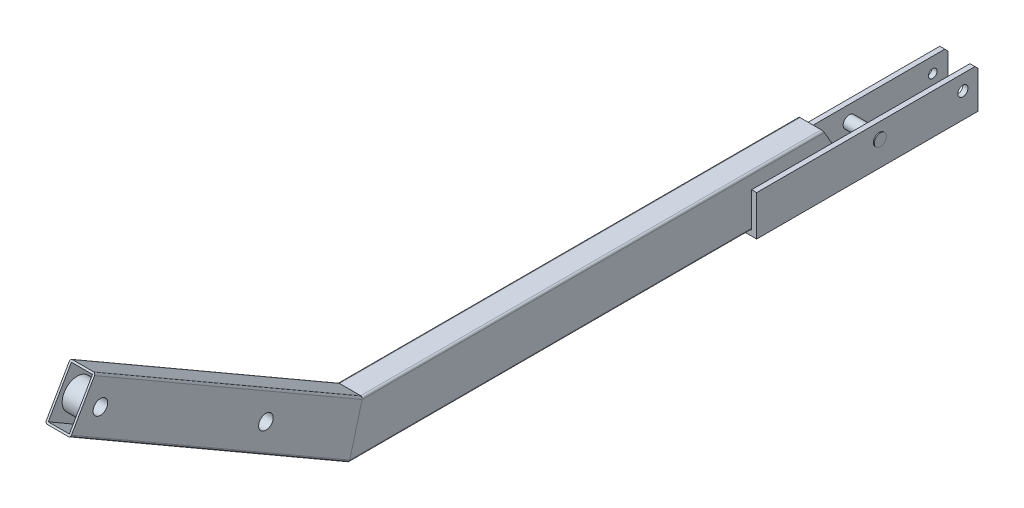
from build123d import *

# Parameters (mm, degrees)
SCHIZZO1_W                               = 21
SCHIZZO1_H                               = 46
ESTRUSIONE_SOTTILE1_DEPTH                = 500
TAGLIO_ESTRUSIONE1_DEPTH                 = 504.115294937
ESTRUSIONE_SOTTILE2_DEPTH                = 120
ESTRUSIONE_SOTTILE2_DEPTH_BACK           = 100
ESTRUSIONE_ESTRUSIONE3_DEPTH             = 1
ESTRUSIONE_ESTRUSIONE3_DEPTH_BACK        = 36
SCHIZZO6_R                               = 6
SCHIZZO7_R                               = 5
TAGLIO_ESTRUSIONE2_DEPTH                 = 10
SMUSSO1_SIZE                             = 3
TAGLIO_ESTRUSIONE3_DEPTH                 = 25
M10_TAPPED_HOLE1_D                       = 8.5
M10_TAPPED_HOLE1_DEPTH                   = 27.5
M10_TAPPED_HOLE1_TIP                     = 2.553657631
ESTRUSIONE_ESTRUSIONE5_DEPTH             = 12.5
RACCORDO1_R                              = 2
SCHIZZO12_W                              = 21
SCHIZZO12_H                              = 46
TAGLIO_ESTRUSIONE4_DEPTH                 = 862.794606464
TAGLIO_ESTRUSIONE5_DEPTH                 = 804.493488257
TAGLIO_ESTRUSIONE5_DEPTH_BACK            = 804.493488257
SCHIZZO13_R                              = 7.25
ESTRUSIONE_ESTRUSIONE6_REACH             = 805.493
SCHIZZO14_R                              = 15
SCHIZZO14_R_2                            = 7.25
ESTRUSIONE_ESTRUSIONE6_DIRECTION_2_REACH = 805.493


with BuildPart() as part:
    # Schizzo1 → Estrusione-Sottile1 (new body)
    with BuildSketch(Plane.XY):
        with BuildLine():
            Line((0, 48), (0, 2))
            ThreePointArc((0, 2), (0.585786438, 0.585786438), (2, 0))
            Line((2, 0), (23, 0))
            ThreePointArc((23, 0), (24.414213562, 0.585786438), (25, 2))
            Line((25, 2), (25, 48))
            ThreePointArc((25, 48), (24.414213562, 49.414213562), (23, 50))
            Line((23, 50), (2, 50))
            ThreePointArc((2, 50), (0.585786438, 49.414213562), (0, 48))
        make_face()
        with Locations((12.5, 25)):
            Rectangle(SCHIZZO1_W, SCHIZZO1_H, mode=Mode.SUBTRACT)
    extrude(amount=ESTRUSIONE_SOTTILE1_DEPTH)

    # Schizzo2 → Taglio-Estrusione1 (cut, through all)
    with BuildSketch(Plane(origin=(25, 0, 0), x_dir=(0, 0, -1), z_dir=(1, 0, 0))):
        Polygon((-500, 0), (-500, 50), (-486.602540378, 50), align=None)
    extrude(amount=-TAGLIO_ESTRUSIONE1_DEPTH, mode=Mode.SUBTRACT)

    # Schizzo5 → Estrusione-Sottile2 (add, two sides: drawn at the far end of the back side and taken through both)
    with BuildSketch(Plane(origin=(0, 0, 0), x_dir=(-1, 0, 0), z_dir=(0, 0, -1)).offset(-ESTRUSIONE_SOTTILE2_DEPTH_BACK)):
        Polygon((-25, 35), (-25, 0), (0, 0), (0, 35), (5, 35), (5, -5), (-30, -5), (-30, 35), align=None)
    extrude(amount=ESTRUSIONE_SOTTILE2_DEPTH + ESTRUSIONE_SOTTILE2_DEPTH_BACK)

    # Schizzo6 → Estrusione-Estrusione3 (add, two sides: drawn at the far end of the back side and taken through both)
    with BuildSketch(Plane(origin=(30, 0, 0), x_dir=(0, 0, -1), z_dir=(1, 0, 0)).offset(-ESTRUSIONE_ESTRUSIONE3_DEPTH_BACK)):
        with Locations((22, 20)):
            Circle(SCHIZZO6_R)
    extrude(amount=ESTRUSIONE_ESTRUSIONE3_DEPTH + ESTRUSIONE_ESTRUSIONE3_DEPTH_BACK)

    # Schizzo7 → Taglio-Estrusione2 (cut)
    with BuildSketch(Plane(origin=(30, 0, 0), x_dir=(0, 0, -1), z_dir=(1, 0, 0))):
        with Locations((105, 20)):
            Circle(SCHIZZO7_R)
    extrude(amount=-TAGLIO_ESTRUSIONE2_DEPTH, mode=Mode.SUBTRACT)

    # Smusso1
    smusso1_edges = [part.edges().sort_by_distance(p)[0] for p in [
        (-2.5, 35, -120),
        (27.5, 35, -120),
    ]]
    chamfer(smusso1_edges, length=SMUSSO1_SIZE)

    # Schizzo8 → Taglio-Estrusione3 (cut)
    with BuildSketch(Plane(origin=(25, 0, 0), x_dir=(0, 0, -1), z_dir=(1, 0, 0))):
        Polygon((0, 0), (-28.867513459, 50), (0, 50), align=None)
    extrude(amount=-TAGLIO_ESTRUSIONE3_DEPTH, mode=Mode.SUBTRACT)

    # M10 Tapped Hole1
    with Locations(Plane.ZY.offset(5)):
        with Locations((-105, 20)):
            Hole(M10_TAPPED_HOLE1_D / 2, depth=M10_TAPPED_HOLE1_DEPTH)
            with Locations((0, 0, -(M10_TAPPED_HOLE1_DEPTH + M10_TAPPED_HOLE1_TIP / 2))):  # 118° drill point
                Cone(0, M10_TAPPED_HOLE1_D / 2, M10_TAPPED_HOLE1_TIP, mode=Mode.SUBTRACT)


with BuildPart() as body_2:
    # Schizzo11 → Estrusione-Estrusione5 (new, symmetric)
    with BuildSketch(Plane(origin=(12.5, 0, 0), x_dir=(0, 0, -1), z_dir=(1, 0, 0))):
        Polygon((-777.128129211, 160), (-752.128129211, 203.301270189), (-486.602540378, 50), (-500, 0), align=None)
    extrude(amount=ESTRUSIONE_ESTRUSIONE5_DEPTH, both=True)

    # Raccordo1
    raccordo1_edges = [body_2.edges().sort_by_distance(p)[0] for p in [
        (0, 80, 638.564064606),
        (25, 80, 638.564064606),
        (0, 126.650635095, 619.365334795),
        (25, 126.650635095, 619.365334795),
    ]]
    fillet(raccordo1_edges, radius=RACCORDO1_R)

    # Schizzo12 → Taglio-Estrusione4 (cut, through all)
    with BuildSketch(Plane(origin=(0, 376.506350946, 652.128129211), x_dir=(1, 0, 0), z_dir=(0, 0.4999999999999913, 0.8660254037844438))):
        with Locations((12.5, -225)):
            Rectangle(SCHIZZO12_W, SCHIZZO12_H)
    extrude(amount=-TAGLIO_ESTRUSIONE4_DEPTH, mode=Mode.SUBTRACT)

    # Schizzo13 → Taglio-Estrusione5 (cut, two sides: drawn at the far end of the back side and taken through both)
    with BuildSketch(Plane(origin=(12.5, 0, 0), x_dir=(0, 0, -1), z_dir=(1, 0, 0)).offset(-TAGLIO_ESTRUSIONE5_DEPTH_BACK)):
        with Locations((-747.307621135, 171.650635095)):
            Circle(SCHIZZO13_R)
        with Locations((-582.762794416, 76.650635095)):
            Circle(SCHIZZO13_R)
    extrude(amount=TAGLIO_ESTRUSIONE5_DEPTH + TAGLIO_ESTRUSIONE5_DEPTH_BACK, mode=Mode.SUBTRACT)

    # Estrusione-Estrusione6: up to this face of the body (flat: up to its plane)
    estrusione_estrusione6_end = Plane(body_2.part.faces().sort_by_distance((2, 102.692889262, 628.177991904))[0])
    # Schizzo14 → Estrusione-Estrusione6 (add, up to the picked face)
    with BuildSketch(Plane(origin=(12.5, 0, 0), x_dir=(0, 0, -1), z_dir=(1, 0, 0)), mode=Mode.PRIVATE) as estrusione_estrusione6_sk1:
        with Locations((-747.307621135, 171.650635095)):
            Circle(SCHIZZO14_R)
        with Locations((-747.307621135, 171.650635095)):
            Circle(SCHIZZO14_R_2, mode=Mode.SUBTRACT)
    estrusione_estrusione6_tool1 = split(extrude(estrusione_estrusione6_sk1.sketch, amount=-ESTRUSIONE_ESTRUSIONE6_REACH, mode=Mode.PRIVATE), bisect_by=estrusione_estrusione6_end, keep=Keep.BOTH, mode=Mode.PRIVATE)
    # Schizzo14 → Estrusione-Estrusione6 (add, up to the picked face)
    with BuildSketch(Plane(origin=(12.5, 0, 0), x_dir=(0, 0, -1), z_dir=(1, 0, 0)), mode=Mode.PRIVATE) as estrusione_estrusione6_sk2:
        with Locations((-582.762794416, 76.650635095)):
            Circle(SCHIZZO14_R)
        with Locations((-582.762794416, 76.650635095)):
            Circle(SCHIZZO14_R_2, mode=Mode.SUBTRACT)
    estrusione_estrusione6_tool2 = split(extrude(estrusione_estrusione6_sk2.sketch, amount=-ESTRUSIONE_ESTRUSIONE6_REACH, mode=Mode.PRIVATE), bisect_by=estrusione_estrusione6_end, keep=Keep.BOTH, mode=Mode.PRIVATE)
    add(estrusione_estrusione6_tool1.solids().sort_by(Axis((12.5, 171.650635, 761.883357), (-1, 0, 0)))[0])
    add(estrusione_estrusione6_tool2.solids().sort_by(Axis((12.5, 76.650635, 597.33853), (-1, 0, 0)))[0])

    # Estrusione-Estrusione6 direction 2: up to this face of the body (flat: up to its plane)
    estrusione_estrusione6_direction_2_end = Plane(body_2.part.faces().sort_by_distance((23, 102.692889262, 628.177991904))[0])
    # Schizzo14 → Estrusione-Estrusione6 direction 2 (add, up to the picked face)
    with BuildSketch(Plane(origin=(12.5, 0, 0), x_dir=(0, 0, -1), z_dir=(1, 0, 0)), mode=Mode.PRIVATE) as estrusione_estrusione6_direction_2_sk1:
        with Locations((-747.307621135, 171.650635095)):
            Circle(SCHIZZO14_R)
        with Locations((-747.307621135, 171.650635095)):
            Circle(SCHIZZO14_R_2, mode=Mode.SUBTRACT)
    estrusione_estrusione6_direction_2_tool1 = split(extrude(estrusione_estrusione6_direction_2_sk1.sketch, amount=ESTRUSIONE_ESTRUSIONE6_DIRECTION_2_REACH, mode=Mode.PRIVATE), bisect_by=estrusione_estrusione6_direction_2_end, keep=Keep.BOTH, mode=Mode.PRIVATE)
    # Schizzo14 → Estrusione-Estrusione6 direction 2 (add, up to the picked face)
    with BuildSketch(Plane(origin=(12.5, 0, 0), x_dir=(0, 0, -1), z_dir=(1, 0, 0)), mode=Mode.PRIVATE) as estrusione_estrusione6_direction_2_sk2:
        with Locations((-582.762794416, 76.650635095)):
            Circle(SCHIZZO14_R)
        with Locations((-582.762794416, 76.650635095)):
            Circle(SCHIZZO14_R_2, mode=Mode.SUBTRACT)
    estrusione_estrusione6_direction_2_tool2 = split(extrude(estrusione_estrusione6_direction_2_sk2.sketch, amount=ESTRUSIONE_ESTRUSIONE6_DIRECTION_2_REACH, mode=Mode.PRIVATE), bisect_by=estrusione_estrusione6_direction_2_end, keep=Keep.BOTH, mode=Mode.PRIVATE)
    add(estrusione_estrusione6_direction_2_tool1.solids().sort_by(Axis((12.5, 171.650635, 761.883357), (1, 0, 0)))[0])
    add(estrusione_estrusione6_direction_2_tool2.solids().sort_by(Axis((12.5, 76.650635, 597.33853), (1, 0, 0)))[0])


solid = Compound([part.part, body_2.part])
